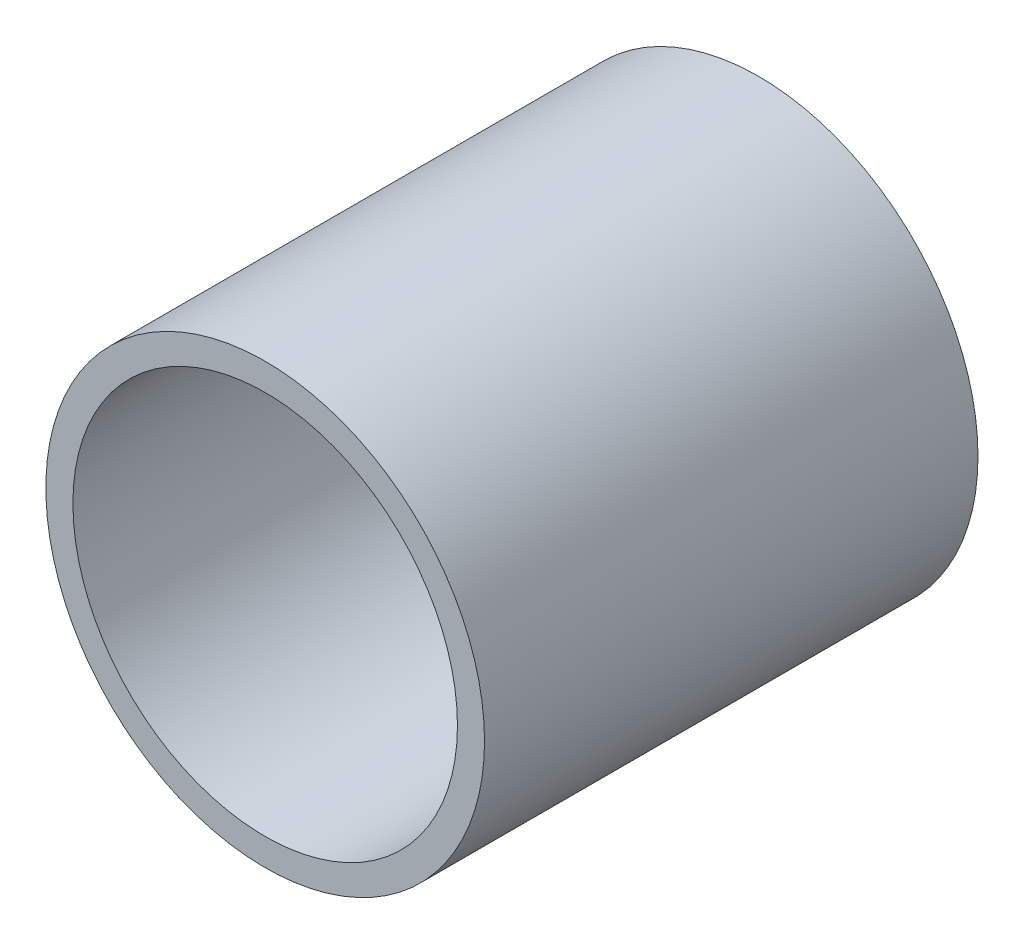
from build123d import *

# Parameters (mm, degrees)
SKETCH1_R           = 44.45
SKETCH1_R_2         = 38.9636
EXTRUDE_THIN1_DEPTH = 50


with BuildPart() as part:
    # Sketch1 → Extrude-Thin1 (new, symmetric)
    with BuildSketch(Plane.XY):
        Circle(SKETCH1_R)
        Circle(SKETCH1_R_2, mode=Mode.SUBTRACT)
    extrude(amount=EXTRUDE_THIN1_DEPTH, both=True)


solid = part.part
